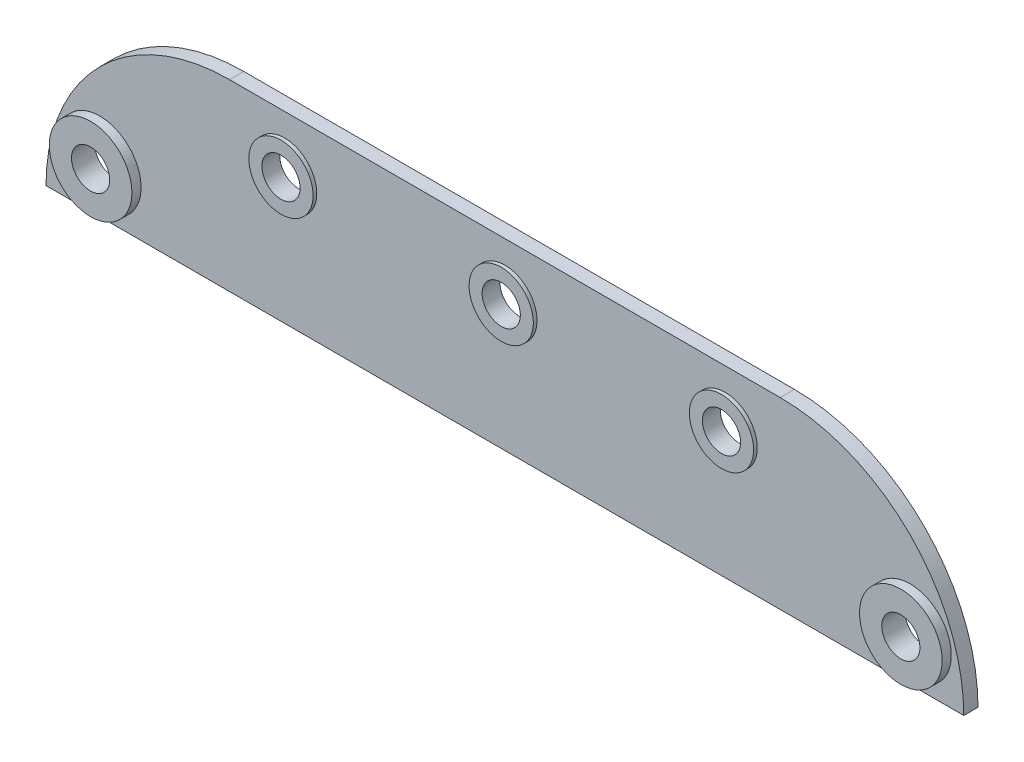
from build123d import *

# Parameters (mm, degrees)
SKETCH1_R           = 4.165
BOSS_EXTRUDE1_DEPTH = 3.1
SKETCH2_R           = 7
SKETCH2_R_2         = 4.165
BOSS_EXTRUDE3_DEPTH = 0.8
SKETCH4_R           = 9
SKETCH4_R_2         = 4.165
BOSS_EXTRUDE4_DEPTH = 2


with BuildPart() as part:
    # Sketch1 → Boss-Extrude1 (new body)
    with BuildSketch(Plane.XY):
        with BuildLine():
            Line((-60, 20), (60, 20))
            ThreePointArc((60, 20), (88.284271247, 8.284271247), (100, -20))
            Line((100, -20), (-100, -20))
            ThreePointArc((-100, -20), (-88.284271247, 8.284271247), (-60, 20))
        make_face()
        with Locations(Location((0, 8, 0), (0, 0, 180))):
            Circle(SKETCH1_R, mode=Mode.SUBTRACT)
        with Locations(Location((48, 8, 0), (0, 0, 180))):
            Circle(SKETCH1_R, mode=Mode.SUBTRACT)
        with Locations(Location((-48, 8, 0), (0, 0, 180))):
            Circle(SKETCH1_R, mode=Mode.SUBTRACT)
        with Locations(Location((-88.284271247, -10, 0), (0, 0, 180))):
            Circle(SKETCH1_R, mode=Mode.SUBTRACT)
        with Locations(Location((88.284271247, -10, 0), (0, 0, 180))):
            Circle(SKETCH1_R, mode=Mode.SUBTRACT)
    extrude(amount=BOSS_EXTRUDE1_DEPTH)

    # Sketch2 → Boss-Extrude3 (add)
    # profile 1 of 3: a face of its own
    with BuildSketch(Plane.XY.offset(3.1)):
        with Locations(Location((-48, 8, 0), (0, 0, 180))):
            Circle(SKETCH2_R)
        with Locations(Location((-48, 8, 0), (0, 0, 180))):
            Circle(SKETCH2_R_2, mode=Mode.SUBTRACT)
    # profile 2 of 3: a face of its own
    with BuildSketch(Plane.XY.offset(3.1)):
        with Locations(Location((0, 8, 0), (0, 0, 180))):
            Circle(SKETCH2_R)
        with Locations(Location((0, 8, 0), (0, 0, 180))):
            Circle(SKETCH2_R_2, mode=Mode.SUBTRACT)
    # profile 3 of 3: a face of its own
    with BuildSketch(Plane.XY.offset(3.1)):
        with Locations(Location((48, 8, 0), (0, 0, 180))):
            Circle(SKETCH2_R)
        with Locations(Location((48, 8, 0), (0, 0, 180))):
            Circle(SKETCH2_R_2, mode=Mode.SUBTRACT)
    extrude(amount=BOSS_EXTRUDE3_DEPTH)

    # Sketch4 → Boss-Extrude4 (add)
    # profile 1 of 2: a face of its own
    with BuildSketch(Plane.XY.offset(3.1)):
        with Locations(Location((-88.284271247, -10, 0), (0, 0, 180))):
            Circle(SKETCH4_R)
        with Locations(Location((-88.284271247, -10, 0), (0, 0, 180))):
            Circle(SKETCH4_R_2, mode=Mode.SUBTRACT)
    # profile 2 of 2: a face of its own
    with BuildSketch(Plane.XY.offset(3.1)):
        with Locations(Location((88.284271247, -10, 0), (0, 0, 180))):
            Circle(SKETCH4_R)
        with Locations(Location((88.284271247, -10, 0), (0, 0, 180))):
            Circle(SKETCH4_R_2, mode=Mode.SUBTRACT)
    extrude(amount=BOSS_EXTRUDE4_DEPTH)


solid = part.part
